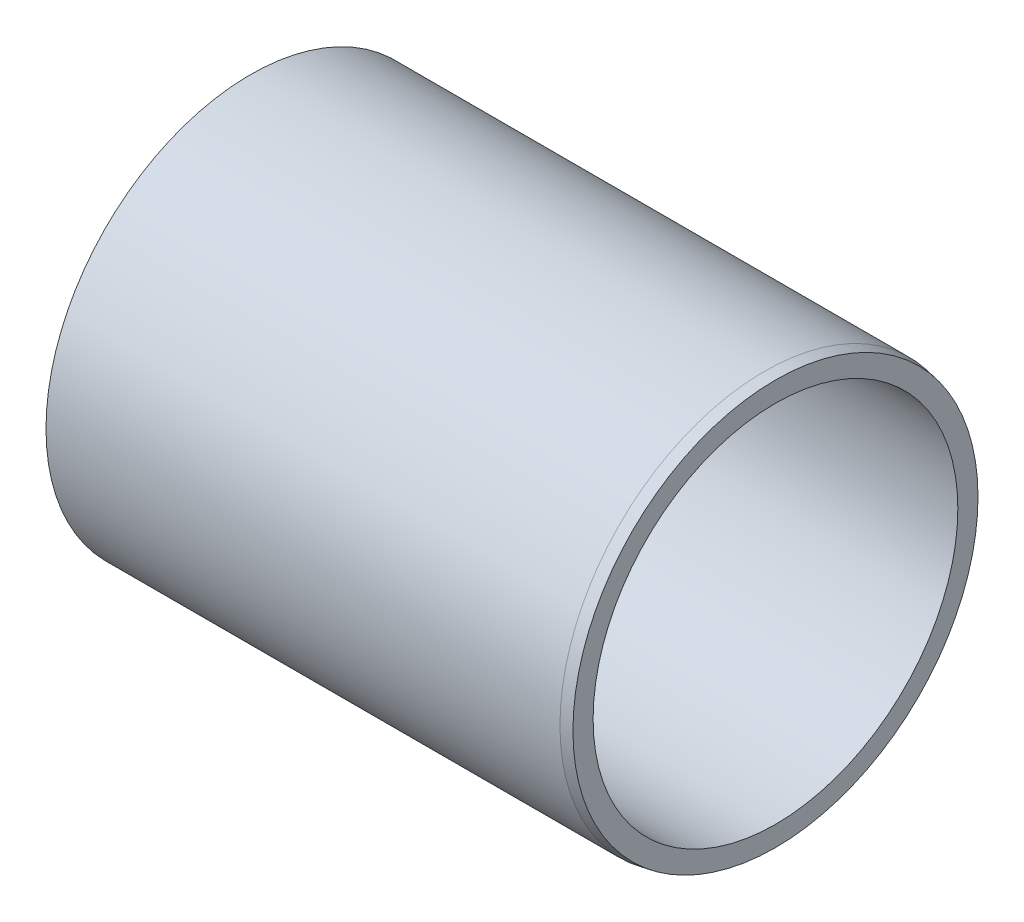
from build123d import *


with BuildPart() as part:
    # Эскиз1 → Повернуть1 (revolve)
    with BuildSketch(Plane.XY, mode=Mode.PRIVATE) as revolve_1_sk:
        Polygon((93, 37), (95, 36.647346039), (95, 33), (0, 33), (0, 37), align=None)
    revolve(revolve_1_sk.sketch.rotate(Axis((0, 0, 0), (1, 0, 0)), 90), axis=Axis((0, 0, 0), (1, 0, 0)))


solid = part.part
